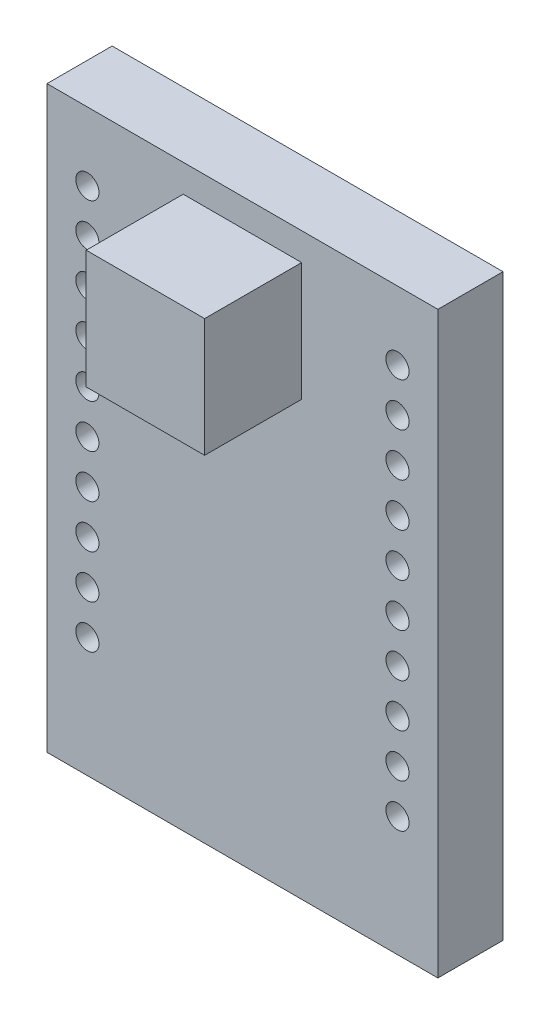
from build123d import *

# Parameters (mm, degrees)
SKETCH1_W           = 27
SKETCH1_H           = 40
BOSS_EXTRUDE1_DEPTH = 4.5
SKETCH2_W           = 8.18
SKETCH2_H           = 8.18
BOSS_EXTRUDE2_DEPTH = 6.7
SKETCH3_R           = 0.8
CUT_EXTRUDE1_DEPTH  = 6.7


with BuildPart() as part:
    # Sketch1 → Boss-Extrude1 (new body)
    with BuildSketch(Plane.XY):
        Rectangle(SKETCH1_W, SKETCH1_H)
    extrude(amount=BOSS_EXTRUDE1_DEPTH)

    # Sketch2 → Boss-Extrude2 (add)
    with BuildSketch(Plane.XY.offset(4.5)):
        with Locations((0, 14)):
            Rectangle(SKETCH2_W, SKETCH2_H)
    extrude(amount=BOSS_EXTRUDE2_DEPTH)

    # Sketch3 → Cut-Extrude1 (cut)
    with BuildSketch(Plane.XY.offset(4.5)):
        with Locations((10.7092899, 15.271061343)):
            Circle(SKETCH3_R)
        with Locations((10.7092899, 12.271061343)):
            Circle(SKETCH3_R)
        with Locations((10.7092899, 9.271061343)):
            Circle(SKETCH3_R)
        with Locations((10.7092899, 6.271061343)):
            Circle(SKETCH3_R)
        with Locations((10.7092899, 3.271061343)):
            Circle(SKETCH3_R)
        with Locations((10.7092899, 0.271061343)):
            Circle(SKETCH3_R)
        with Locations((10.7092899, -2.728938657)):
            Circle(SKETCH3_R)
        with Locations((10.7092899, -5.728938657)):
            Circle(SKETCH3_R)
        with Locations((10.7092899, -8.728938657)):
            Circle(SKETCH3_R)
        with Locations((10.7092899, -11.728938657)):
            Circle(SKETCH3_R)
    cut_extrude1 = extrude(amount=-CUT_EXTRUDE1_DEPTH, mode=Mode.SUBTRACT)

    # Mirror1: Cut-Extrude1 across plane
    add(cut_extrude1.mirror(Plane(origin=(0, 0, 0), x_dir=(0, 0, 1), z_dir=(1, 0, 0))), mode=Mode.SUBTRACT)


solid = part.part
